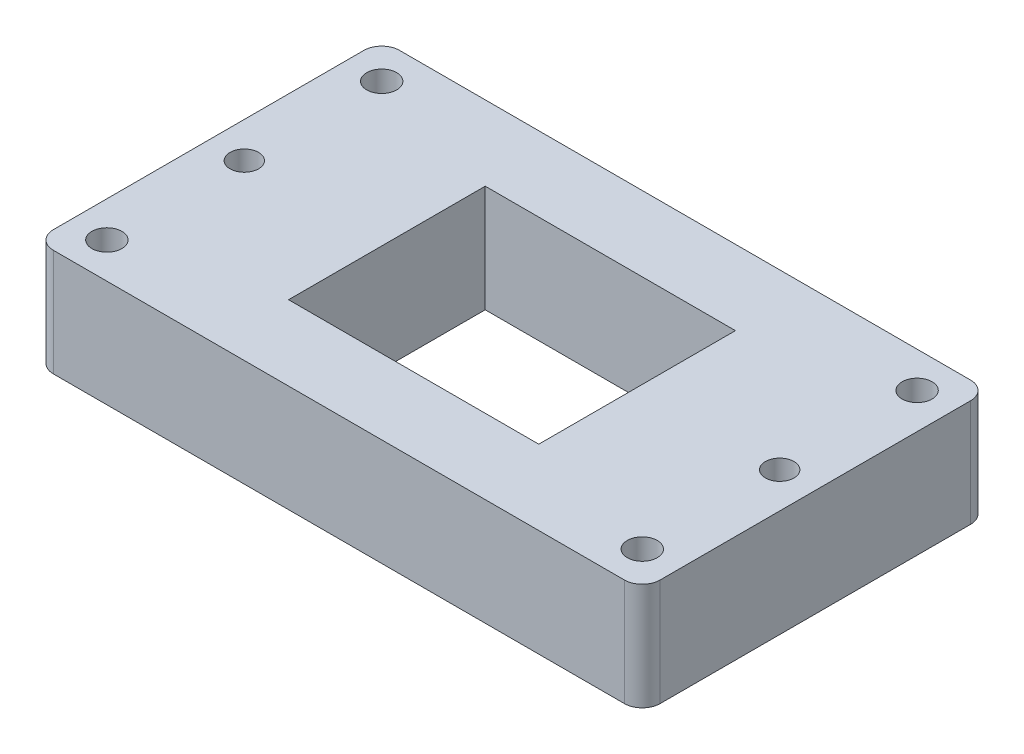
from build123d import *

# Parameters (mm, degrees)
SKETCH1_W             = 170
SKETCH1_H             = 97
BOSS_EXTRUDE1_DEPTH   = 30
FILLET1_R             = 5
SKETCH2_W             = 70.1
SKETCH2_H             = 55.1
CUT_EXTRUDE3_DEPTH    = 103.358438831
F_8_0MM_DOWEL_HOLE1_D = 8
M8_CLEARANCE_HOLE1_D  = 8.4


with BuildPart() as part:
    # Sketch1 → Boss-Extrude1 (new body)
    with BuildSketch(Plane(origin=(0, 0, 0), x_dir=(1, 0, 0), z_dir=(0, 1, 0))):
        Rectangle(SKETCH1_W, SKETCH1_H)
    extrude(amount=-BOSS_EXTRUDE1_DEPTH)

    # Fillet1
    fillet1_edges = [part.edges().sort_by_distance(p)[0] for p in [
        (85, -15, 48.5),
        (-85, -15, 48.5),
        (-85, -15, -48.5),
        (85, -15, -48.5),
    ]]
    fillet(fillet1_edges, radius=FILLET1_R)

    # Sketch2 → Cut-Extrude3 (cut, through all)
    with BuildSketch(Plane(origin=(0, -30, 0), x_dir=(1, 0, 0), z_dir=(0, 1, 0))):
        Rectangle(SKETCH2_W, SKETCH2_H)
    extrude(amount=CUT_EXTRUDE3_DEPTH, mode=Mode.SUBTRACT)

    # Ø8.0mm Dowel Hole1 (through all)
    with Locations(Plane(origin=(0, 0, 0), x_dir=(1, 0, 0), z_dir=(0, 1, 0))):
        with Locations((-75, 0), (75, 0)):
            Hole(F_8_0MM_DOWEL_HOLE1_D / 2)

    # M8 Clearance Hole1 (through all)
    with Locations(Plane(origin=(0, 0, 0), x_dir=(1, 0, 0), z_dir=(0, 1, 0))):
        with Locations((-75, 38.5), (-75, -38.5), (75, -38.5), (75, 38.5)):
            Hole(M8_CLEARANCE_HOLE1_D / 2)


solid = part.part
